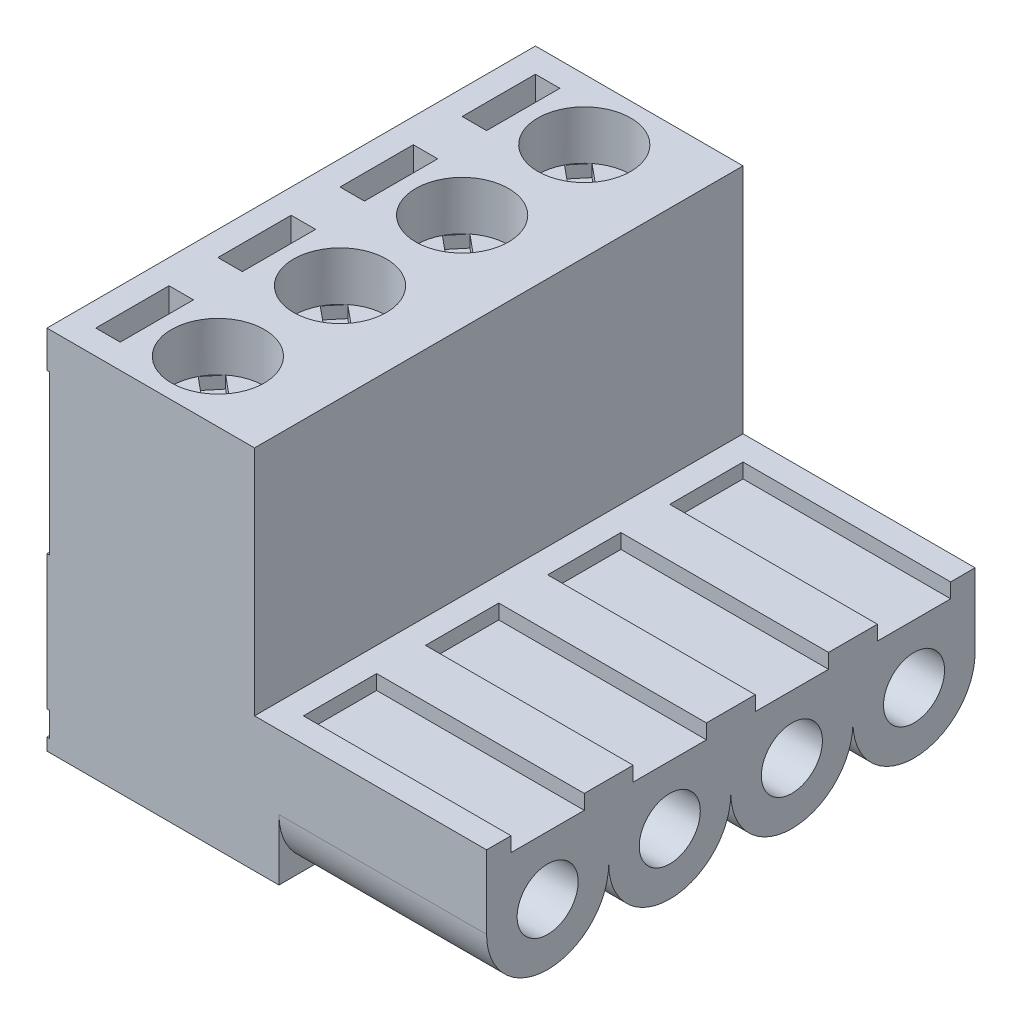
from build123d import *

# Parameters (mm, degrees)
EXTRUDE_1_DEPTH        = 25
SKETCH_2_R             = 1.25
EXTRUDE_2_DEPTH        = 8.5
PATTERN_LINEAR_1_COUNT = 5
PATTERN_LINEAR_1_PITCH = 5
SKETCH_3_W             = 3
SKETCH_3_H             = 3.3
CUT_EXTRUDE_1_DEPTH    = 3
PATTERN_LINEAR_2_COUNT = 5
PATTERN_LINEAR_2_PITCH = 5
CUT_EXTRUDE_2_DEPTH    = 0.1
SKETCH_5_W             = 25
SKETCH_5_H             = 1
CUT_EXTRUDE_3_DEPTH    = 0.1
SKETCH_6_R             = 1.9
CUT_EXTRUDE_4_DEPTH    = 2
PATTERN_LINEAR_3_COUNT = 5
PATTERN_LINEAR_3_PITCH = 5
SKETCH_7_W             = 1
SKETCH_7_H             = 3
CUT_EXTRUDE_5_DEPTH    = 2
PATTERN_LINEAR_4_COUNT = 5
PATTERN_LINEAR_4_PITCH = 5
CUT_EXTRUDE_6_DEPTH    = 0.5
PATTERN_LINEAR_5_COUNT = 5
PATTERN_LINEAR_5_PITCH = 5
SKETCH_9_W             = 18
SKETCH_9_H             = 15
CUT_EXTRUDE_7_DEPTH    = 5


with BuildPart() as part:
    # Эскиз1 → Вытянуть1 (new body)
    with BuildSketch(Plane.XY):
        Polygon((0, 0), (9.5, 0), (9.5, 5.5), (8.5, 5.5), (8.5, 15), (0, 15), align=None)
    extrude(amount=EXTRUDE_1_DEPTH)

    # Эскиз2 → Вытянуть2 (add)
    with BuildSketch(Plane(origin=(9.5, 0, 0), x_dir=(0, 0, -1), z_dir=(1, 0, 0))):
        with BuildLine():
            Line((-25, 5.5), (-24, 5.5))
            Line((-24, 5.5), (-24, 4.9))
            Line((-24, 4.9), (-21, 4.9))
            Line((-21, 4.9), (-21, 5.5))
            Line((-21, 5.5), (-20, 5.5))
            Line((-20, 5.5), (-20, 2.5))
            ThreePointArc((-20, 2.5), (-22.5, 0), (-25, 2.5))
            Line((-25, 2.5), (-25, 5.5))
        make_face()
        with Locations((-22.5, 2.5)):
            Circle(SKETCH_2_R, mode=Mode.SUBTRACT)
    extrude_2 = extrude(amount=EXTRUDE_2_DEPTH)

    # Линейный массив1: Вытянуть2 ×5
    with Locations(*[(0, 0, -i * PATTERN_LINEAR_1_PITCH) for i in range(1, PATTERN_LINEAR_1_COUNT)]):
        add(extrude_2)

    # Эскиз3 → Вырез-Вытянуть1 (cut)
    with BuildSketch(Plane.ZY):
        with Locations((2.5, 4.15)):
            Rectangle(SKETCH_3_W, SKETCH_3_H)
    cut_extrude_1 = extrude(amount=-CUT_EXTRUDE_1_DEPTH, mode=Mode.SUBTRACT)

    # Линейный массив2: Вырез-Вытянуть1 ×5
    with Locations(*[(0, 0, i * PATTERN_LINEAR_2_PITCH) for i in range(1, PATTERN_LINEAR_2_COUNT)]):
        add(cut_extrude_1, mode=Mode.SUBTRACT)

    # Эскиз4 → Вырез-Вытянуть2 (cut)
    with BuildSketch(Plane.ZY):
        Polygon((0, 13.5), (25, 13.5), (25, 12.5), (25.5, 12.5), (25.5, 7), (24.5, 7), (24.5, 12.5), (20.5, 12.5), (20.5, 7), (19.5, 7), (19.5, 12.5), (15.5, 12.5), (15.5, 7), (14.5, 7), (14.5, 12.5), (10.5, 12.5), (10.5, 7), (9.5, 7), (9.5, 12.5), (5.5, 12.5), (5.5, 7), (4.5, 7), (4.5, 12.5), (0, 12.5), align=None)
    extrude(amount=-CUT_EXTRUDE_2_DEPTH, mode=Mode.SUBTRACT)

    # Эскиз5 → Вырез-Вытянуть3 (cut)
    with BuildSketch(Plane.ZY):
        with Locations((12.5, 1)):
            Rectangle(SKETCH_5_W, SKETCH_5_H)
    extrude(amount=-CUT_EXTRUDE_3_DEPTH, mode=Mode.SUBTRACT)

    # Эскиз6 → Вырез-Вытянуть4 (cut)
    with BuildSketch(Plane(origin=(0, 15, 0), x_dir=(-1, 0, 0), z_dir=(0, 1, 0))):
        with Locations(Location((-4.5, 2.5, 0), (0, 0, 90))):
            Circle(SKETCH_6_R)
    cut_extrude_4 = extrude(amount=-CUT_EXTRUDE_4_DEPTH, mode=Mode.SUBTRACT)

    # Линейный массив3: Вырез-Вытянуть4 ×5
    with Locations(*[(0, 0, i * PATTERN_LINEAR_3_PITCH) for i in range(1, PATTERN_LINEAR_3_COUNT)]):
        add(cut_extrude_4, mode=Mode.SUBTRACT)

    # Эскиз7 → Вырез-Вытянуть5 (cut)
    with BuildSketch(Plane(origin=(0, 15, 0), x_dir=(-1, 0, 0), z_dir=(0, 1, 0))):
        with Locations((-1.5, 2.5)):
            Rectangle(SKETCH_7_W, SKETCH_7_H)
    cut_extrude_5 = extrude(amount=-CUT_EXTRUDE_5_DEPTH, mode=Mode.SUBTRACT)

    # Линейный массив4: Вырез-Вытянуть5 ×5
    with Locations(*[(0, 0, i * PATTERN_LINEAR_4_PITCH) for i in range(1, PATTERN_LINEAR_4_COUNT)]):
        add(cut_extrude_5, mode=Mode.SUBTRACT)

    # Эскиз8 → Вырез-Вытянуть6 (cut)
    with BuildSketch(Plane(origin=(0, 13, 0), x_dir=(-1, 0, 0), z_dir=(0, 1, 0))):
        Polygon((-6.185425231, 3.377121309), (-3.325012579, 1.006880929), (-2.814574769, 1.622878691), (-5.674987421, 3.993119071), align=None)
    cut_extrude_6 = extrude(amount=-CUT_EXTRUDE_6_DEPTH, mode=Mode.SUBTRACT)

    # Линейный массив5: Вырез-Вытянуть6 ×5
    with Locations(*[(0, 0, i * PATTERN_LINEAR_5_PITCH) for i in range(1, PATTERN_LINEAR_5_COUNT)]):
        add(cut_extrude_6, mode=Mode.SUBTRACT)

    # Эскиз9 → Вырез-Вытянуть7 (cut)
    with BuildSketch(Plane.XY.offset(25)):
        with Locations((9, 7.5)):
            Rectangle(SKETCH_9_W, SKETCH_9_H)
    extrude(amount=-CUT_EXTRUDE_7_DEPTH, mode=Mode.SUBTRACT)


solid = part.part
